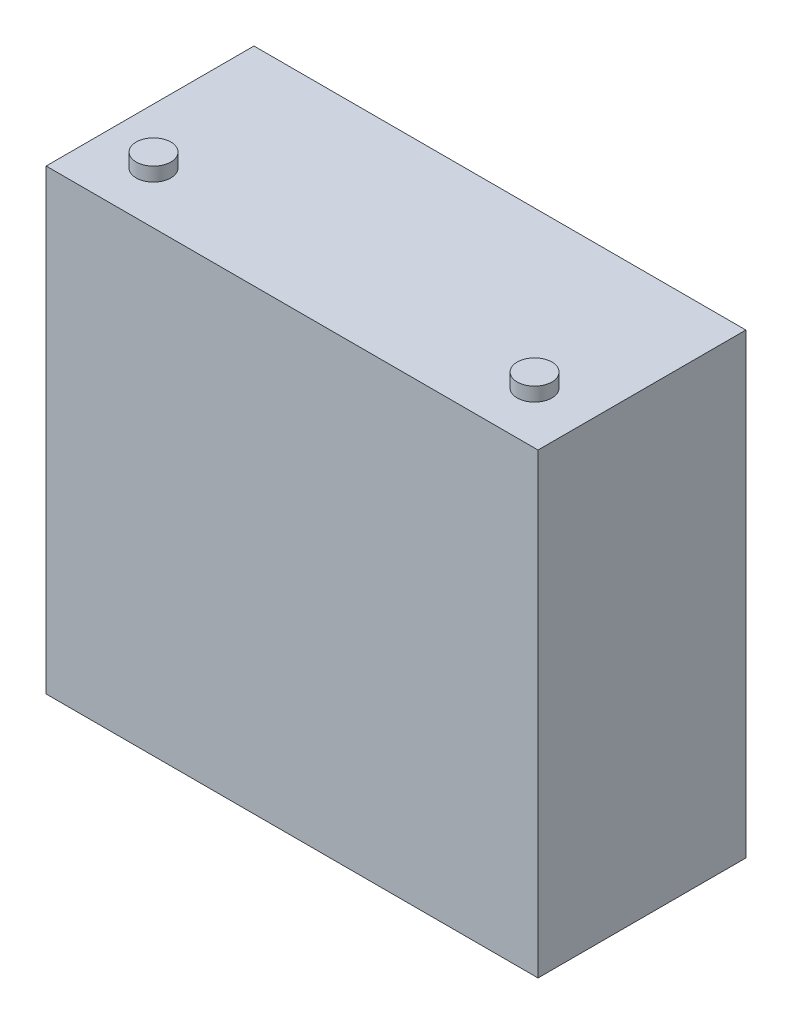
from build123d import *

# Parameters (mm, degrees)
SKETCH1_W           = 180.34
SKETCH1_H           = 76.2
BOSS_EXTRUDE1_DEPTH = 167.64
SKETCH2_R           = 6.35
BOSS_EXTRUDE2_DEPTH = 5.08


with BuildPart() as part:
    # Sketch1 → Boss-Extrude1 (new body)
    with BuildSketch(Plane(origin=(0, 0, 0), x_dir=(1, 0, 0), z_dir=(0, 1, 0))):
        Rectangle(SKETCH1_W, SKETCH1_H)
    extrude(amount=BOSS_EXTRUDE1_DEPTH)

    # Sketch2 → Boss-Extrude2 (add)
    with BuildSketch(Plane(origin=(0, 167.64, 0), x_dir=(1, 0, 0), z_dir=(0, 1, 0))):
        with Locations(Location((-69.85, -19.05, 0), (0, 0, 90))):
            Circle(SKETCH2_R)
        with Locations(Location((69.85, -19.05, 0), (0, 0, 90))):
            Circle(SKETCH2_R)
    extrude(amount=BOSS_EXTRUDE2_DEPTH)


solid = part.part
